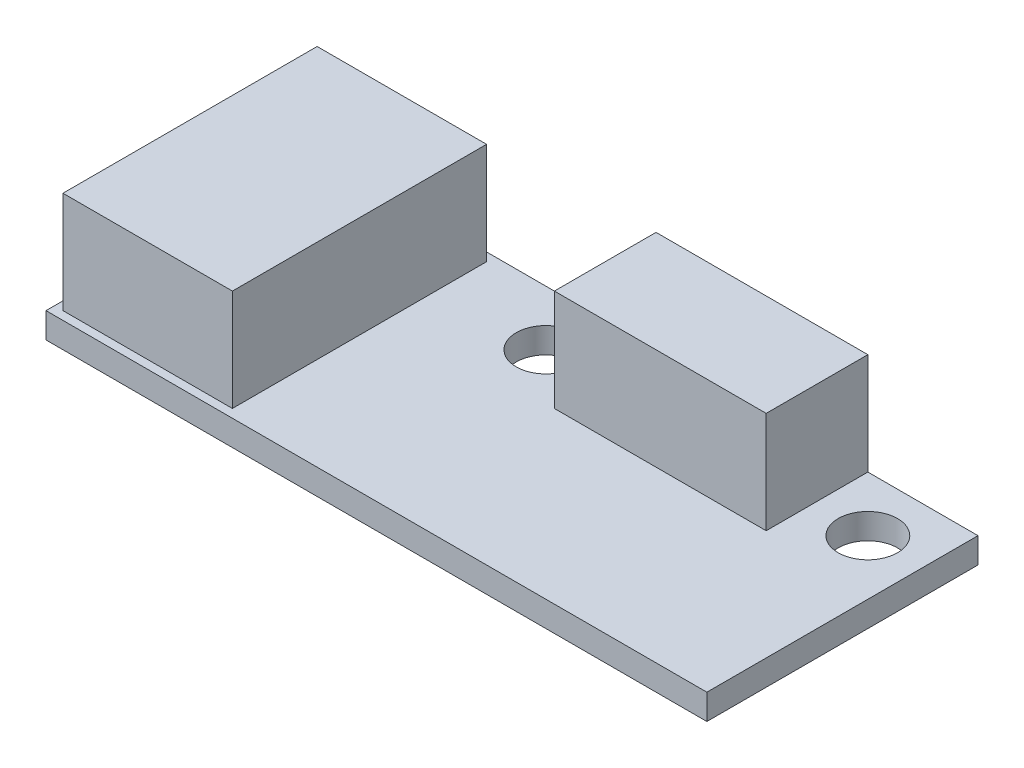
from build123d import *

# Parameters (mm, degrees)
SKETCH_1_W          = 39
SKETCH_1_H          = 16
EXTRUDE_1_DEPTH     = 1.5
SKETCH_2_R          = 1.75
CUT_EXTRUDE_1_DEPTH = 1.5
SKETCH_3_W          = 12.5
SKETCH_3_H          = 6
EXTRUDE_2_DEPTH     = 6
SKETCH_4_W          = 10
SKETCH_4_H          = 15
EXTRUDE_3_DEPTH     = 6


with BuildPart() as part:
    # 草图1 → 凸台-拉伸1 (new body)
    with BuildSketch(Plane(origin=(0, 0, 0), x_dir=(1, 0, 0), z_dir=(0, 1, 0))):
        Rectangle(SKETCH_1_W, SKETCH_1_H)
    extrude(amount=EXTRUDE_1_DEPTH)

    # 草图2 → 切除-拉伸1 (cut)
    with BuildSketch(Plane(origin=(0, 1.5, 0), x_dir=(1, 0, 0), z_dir=(0, 1, 0))):
        with Locations(Location((16.25, 4.75, 0), (0, 0, 270))):
            Circle(SKETCH_2_R)
        with Locations(Location((-2.75, 4.75, 0), (0, 0, 270))):
            Circle(SKETCH_2_R)
    extrude(amount=-CUT_EXTRUDE_1_DEPTH, mode=Mode.SUBTRACT)

    # 草图3 → 凸台-拉伸2 (add)
    with BuildSketch(Plane(origin=(0, 1.5, 0), x_dir=(1, 0, 0), z_dir=(0, 1, 0))):
        with Locations((6.75, 5)):
            Rectangle(SKETCH_3_W, SKETCH_3_H)
    extrude(amount=EXTRUDE_2_DEPTH)

    # 草图4 → 凸台-拉伸3 (add)
    with BuildSketch(Plane(origin=(0, 1.5, 0), x_dir=(1, 0, 0), z_dir=(0, 1, 0))):
        with Locations((-14, 0)):
            Rectangle(SKETCH_4_W, SKETCH_4_H)
    extrude(amount=EXTRUDE_3_DEPTH)


solid = part.part
